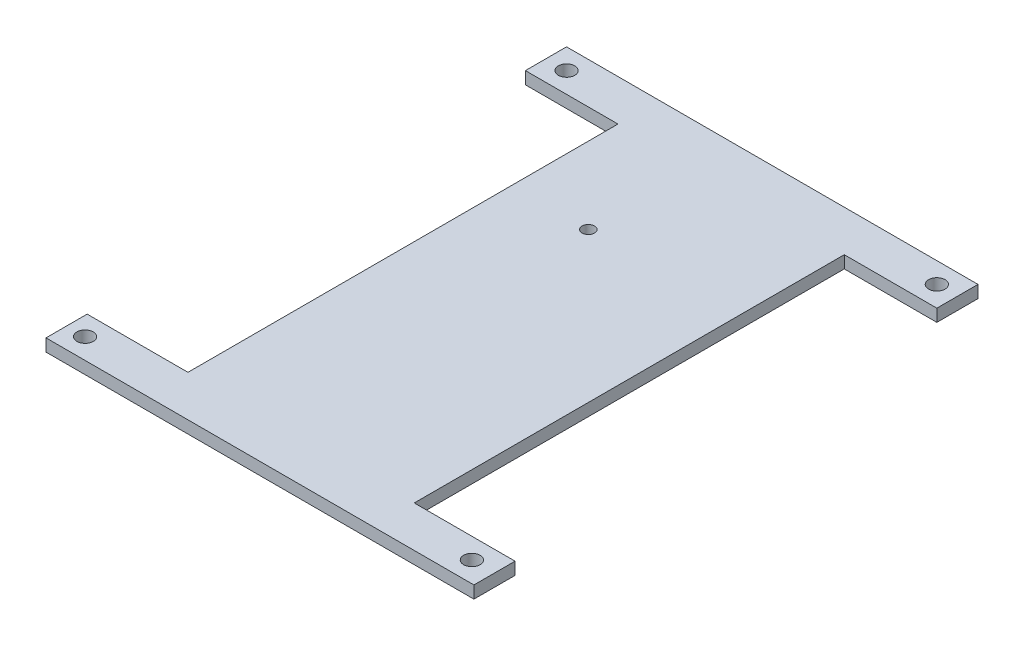
from build123d import *

# Parameters (mm, degrees)
CROQUIS1_R              = 75
SALIENTE_EXTRUIR1_DEPTH = 3
CROQUIS5_W              = 55
CROQUIS5_H              = 104.51
CORTAR_EXTRUIR10_DEPTH  = 107.108435103
CROQUIS10_W             = 100
CROQUIS10_H             = 10
CROQUIS10_R             = 2
SALIENTE_EXTRUIR2_DEPTH = 3
CROQUIS12_W             = 104
CROQUIS12_H             = 10
CROQUIS12_R             = 2
SALIENTE_EXTRUIR3_DEPTH = 3
CROQUIS13_R             = 1.5
CORTAR_EXTRUIR11_DEPTH  = 84.294657692


with BuildPart() as part:
    # Croquis1 → Saliente-Extruir1 (new body)
    with BuildSketch(Plane(origin=(0, 0, 0), x_dir=(1, 0, 0), z_dir=(0, 1, 0))):
        with Locations(Location((0, 0, 0), (0, 0, 270))):
            Circle(CROQUIS1_R)
    extrude(amount=SALIENTE_EXTRUIR1_DEPTH)

    # Croquis5 → Cortar-Extruir10 (cut, through all)
    with BuildSketch(Plane(origin=(0, 3, 0), x_dir=(1, 0, 0), z_dir=(0, 1, 0))):
        Polygon((53, 55), (53, 77), (-53, 77), (-53, 55), (-77.5, 55), (-77.5, -70), (-27.5, -70), (-27.5, -78), (27.5, -78), (27.5, -70), (75, -70), (75, 55), align=None)
        with Locations((0, 2.745)):
            Rectangle(CROQUIS5_W, CROQUIS5_H, mode=Mode.SUBTRACT)
    extrude(amount=-CORTAR_EXTRUIR10_DEPTH, mode=Mode.SUBTRACT)

    # Croquis10 → Saliente-Extruir2 (add)
    with BuildSketch(Plane(origin=(0, 3, 0), x_dir=(1, 0, 0), z_dir=(0, 1, 0))):
        with Locations((0, 60)):
            Rectangle(CROQUIS10_W, CROQUIS10_H)
        with Locations(Location((-45, 60, 0), (0, 0, 270))):
            Circle(CROQUIS10_R, mode=Mode.SUBTRACT)
        with Locations(Location((45, 60, 0), (0, 0, 270))):
            Circle(CROQUIS10_R, mode=Mode.SUBTRACT)
    extrude(amount=-SALIENTE_EXTRUIR2_DEPTH)

    # Croquis12 → Saliente-Extruir3 (add)
    with BuildSketch(Plane(origin=(0, 3, 0), x_dir=(1, 0, 0), z_dir=(0, 1, 0))):
        with Locations((0, -54.51)):
            Rectangle(CROQUIS12_W, CROQUIS12_H)
        with Locations(Location((-47.5, -54.51, 0), (0, 0, 270))):
            Circle(CROQUIS12_R, mode=Mode.SUBTRACT)
        with Locations(Location((46.5, -54.51, 0), (0, 0, 270))):
            Circle(CROQUIS12_R, mode=Mode.SUBTRACT)
    extrude(amount=-SALIENTE_EXTRUIR3_DEPTH)

    # Croquis13 → Cortar-Extruir11 (cut, through all)
    with BuildSketch(Plane(origin=(0, 3, 0), x_dir=(1, 0, 0), z_dir=(0, 1, 0))):
        with Locations(Location((-8.9, 29.2, 0), (0, 0, 270))):
            Circle(CROQUIS13_R)
    extrude(amount=-CORTAR_EXTRUIR11_DEPTH, mode=Mode.SUBTRACT)


solid = part.part
